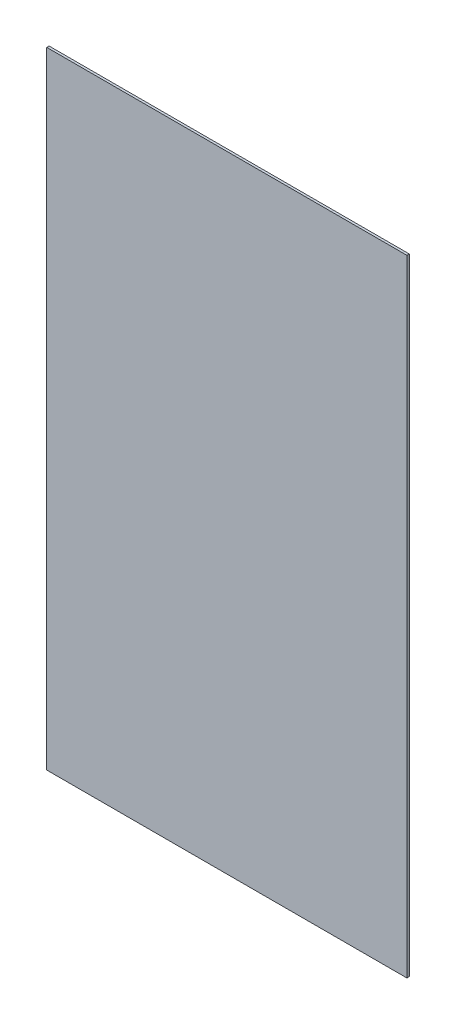
from build123d import *

# Parameters (mm, degrees)
SKETCH1_W           = 305
SKETCH1_H           = 530
BOSS_EXTRUDE1_DEPTH = 2


with BuildPart() as part:
    # Sketch1 → Boss-Extrude1 (new body)
    with BuildSketch(Plane.XY):
        with Locations((-35.401785714, -73.013392857)):
            Rectangle(SKETCH1_W, SKETCH1_H)
    extrude(amount=BOSS_EXTRUDE1_DEPTH)


solid = part.part
